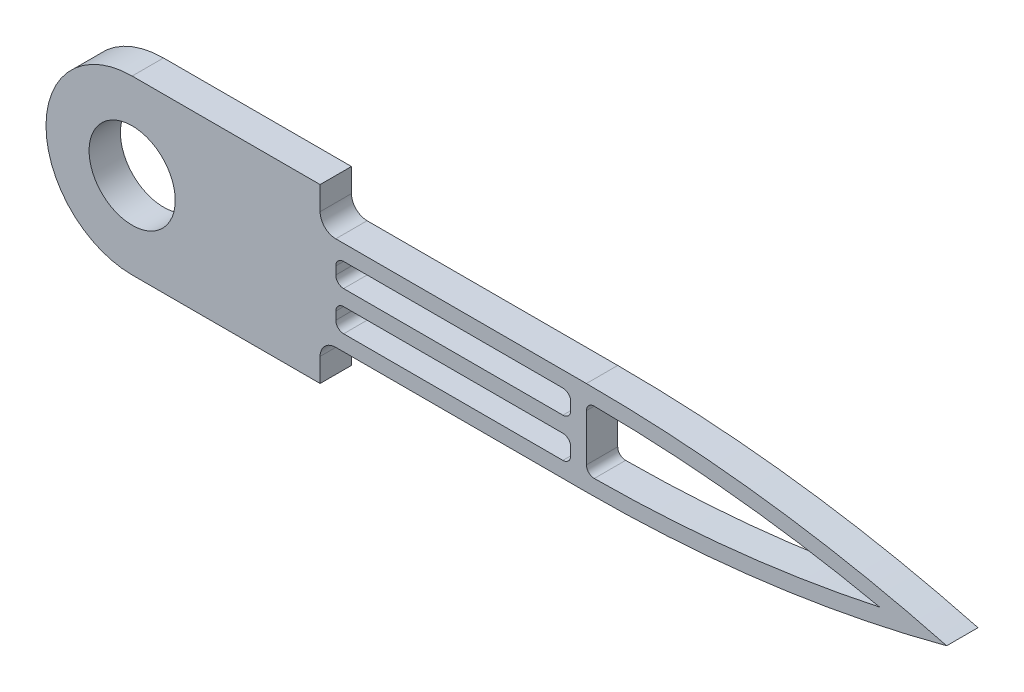
from build123d import *

# Parameters (mm, degrees)
BOSS_EXTRUDE1_DEPTH = 5.08
SKETCH2_R           = 6.985
CUT_EXTRUDE1_DEPTH  = 133.913858194
FILLET1_R           = 2.54
SKETCH3_W           = 38.1
SKETCH3_H           = 3.81
CUT_EXTRUDE2_DEPTH  = 133.913858194
FILLET2_R           = 1.27


with BuildPart() as part:
    # Sketch1 → Boss-Extrude1 (new body)
    with BuildSketch(Plane.XY):
        with BuildLine():
            Line((0, 13.97), (30.48, 13.97))
            Line((30.48, 13.97), (30.48, 7.62))
            Line((30.48, 7.62), (73.66, 7.62))
            ThreePointArc((73.66, 7.62), (103.117430302, 5.706965649), (132.08, 0))
            ThreePointArc((132.08, 0), (103.117430302, -5.706965649), (73.66, -7.62))
            Line((73.66, -7.62), (30.48, -7.62))
            Line((30.48, -7.62), (30.48, -13.97))
            Line((30.48, -13.97), (0, -13.97))
            ThreePointArc((0, -13.97), (-13.97, 0), (0, 13.97))
        make_face()
    extrude(amount=BOSS_EXTRUDE1_DEPTH)

    # Sketch2 → Cut-Extrude1 (cut, through all)
    with BuildSketch(Plane.XY.offset(5.08)):
        Circle(SKETCH2_R)
    extrude(amount=-CUT_EXTRUDE1_DEPTH, mode=Mode.SUBTRACT)

    # Fillet1
    fillet1_edges = [part.edges().sort_by_distance(p)[0] for p in [
        (30.48, -7.62, 2.54),
        (30.48, 7.62, 2.54),
    ]]
    fillet(fillet1_edges, radius=FILLET1_R)

    # Sketch3 → Cut-Extrude2 (cut, through all)
    with BuildSketch(Plane.XY.offset(5.08)):
        with Locations((52.07, -3.175)):
            Rectangle(SKETCH3_W, SKETCH3_H)
        with Locations((52.07, 3.175)):
            Rectangle(SKETCH3_W, SKETCH3_H)
        with BuildLine():
            Line((73.66, -5.08), (73.66, 5.08))
            ThreePointArc((73.66, 5.08), (97.577396737, 3.806398837), (121.224283519, 0))
            ThreePointArc((121.224283519, 0), (97.577396737, -3.806398837), (73.66, -5.08))
        make_face()
    extrude(amount=-CUT_EXTRUDE2_DEPTH, mode=Mode.SUBTRACT)

    # Fillet2
    fillet2_edges = [part.edges().sort_by_distance(p)[0] for p in [
        (73.66, -5.08, 2.54),
        (73.66, 5.08, 2.54),
        (71.12, 1.27, 2.54),
        (33.02, 1.27, 2.54),
        (33.02, 5.08, 2.54),
        (71.12, 5.08, 2.54),
        (71.12, -1.27, 2.54),
        (71.12, -5.08, 2.54),
        (33.02, -5.08, 2.54),
        (33.02, -1.27, 2.54),
    ]]
    fillet(fillet2_edges, radius=FILLET2_R)


solid = part.part
